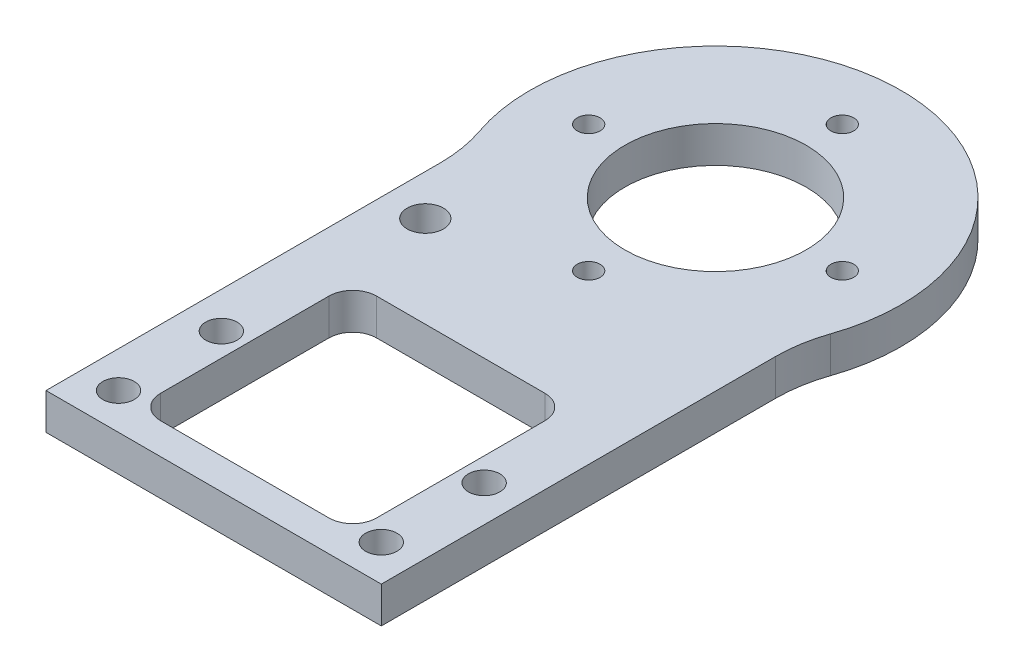
from build123d import *

# Parameters (mm, degrees)
SKETCH1_R           = 2.75
SKETCH1_R_2         = 15.875
SKETCH1_R_3         = 2
BOSS_EXTRUDE1_DEPTH = 6.35
SKETCH2_R           = 3.175
CUT_EXTRUDE1_DEPTH  = 171.942179124


with BuildPart() as part:
    # Sketch1 → Boss-Extrude1 (new body)
    with BuildSketch(Plane.XZ.offset(-199.631527043)):
        with BuildLine():
            Line((-29.35, -47.354073009), (29.35, -47.354073009))
            Line((29.35, -47.354073009), (29.35, -116.366676692))
            ThreePointArc((29.35, -116.366676692), (29.697848179, -120.5559116), (30.731865285, -124.630404955))
            ThreePointArc((30.731865285, -124.630404955), (0, -167.704073009), (-30.731865285, -124.630404955))
            ThreePointArc((-30.731865285, -124.630404955), (-29.697848179, -120.5559116), (-29.35, -116.366676692))
            Line((-29.35, -116.366676692), (-29.35, -47.354073009))
        make_face()
        with Locations(Location((-23, -71.704073009, 0), (0, 0, 270))):
            Circle(SKETCH1_R, mode=Mode.SUBTRACT)
        with Locations(Location((-23, -53.704073009, 0), (0, 0, 270))):
            Circle(SKETCH1_R, mode=Mode.SUBTRACT)
        with Locations(Location((23, -53.704073009, 0), (0, 0, 270))):
            Circle(SKETCH1_R, mode=Mode.SUBTRACT)
        with Locations(Location((23, -71.704073009, 0), (0, 0, 270))):
            Circle(SKETCH1_R, mode=Mode.SUBTRACT)
        with Locations(Location((0, -135.204073009, 0), (0, 0, 270))):
            Circle(SKETCH1_R_2, mode=Mode.SUBTRACT)
        with Locations(Location((-22.20000005, -135.204073009, 0), (0, 0, 270))):
            Circle(SKETCH1_R_3, mode=Mode.SUBTRACT)
        with Locations(Location((0, -113.004072959, 0), (0, 0, 270))):
            Circle(SKETCH1_R_3, mode=Mode.SUBTRACT)
        with Locations(Location((22.20000005, -135.204073009, 0), (0, 0, 270))):
            Circle(SKETCH1_R_3, mode=Mode.SUBTRACT)
        with Locations(Location((0, -157.404073059, 0), (0, 0, 270))):
            Circle(SKETCH1_R_3, mode=Mode.SUBTRACT)
        with BuildLine():
            Line((-14.739402973, -52.799073011), (14.739402973, -52.799073011))
            ThreePointArc((14.739402973, -52.799073011), (17.684924877, -54.019148132), (18.905, -56.964670036))
            Line((18.905, -56.964670036), (18.905, -86.443475982))
            ThreePointArc((18.905, -86.443475982), (17.684924878, -89.388997884), (14.739402976, -90.609073006))
            Line((14.739402976, -90.609073006), (-14.739402973, -90.609073006))
            ThreePointArc((-14.739402973, -90.609073006), (-17.684924877, -89.388997886), (-18.905, -86.443475982))
            Line((-18.905, -86.443475982), (-18.905, -56.964670036))
            ThreePointArc((-18.905, -56.964670036), (-17.684924877, -54.019148132), (-14.739402973, -52.799073011))
        make_face(mode=Mode.SUBTRACT)
    extrude(amount=BOSS_EXTRUDE1_DEPTH)

    # Sketch2 → Cut-Extrude1 (cut, through all)
    with BuildSketch(Plane.XZ.offset(-193.281527043)):
        with Locations(Location((-22.225, -106.629073009, 0), (0, 0, 270))):
            Circle(SKETCH2_R)
    extrude(amount=-CUT_EXTRUDE1_DEPTH, mode=Mode.SUBTRACT)


solid = part.part
